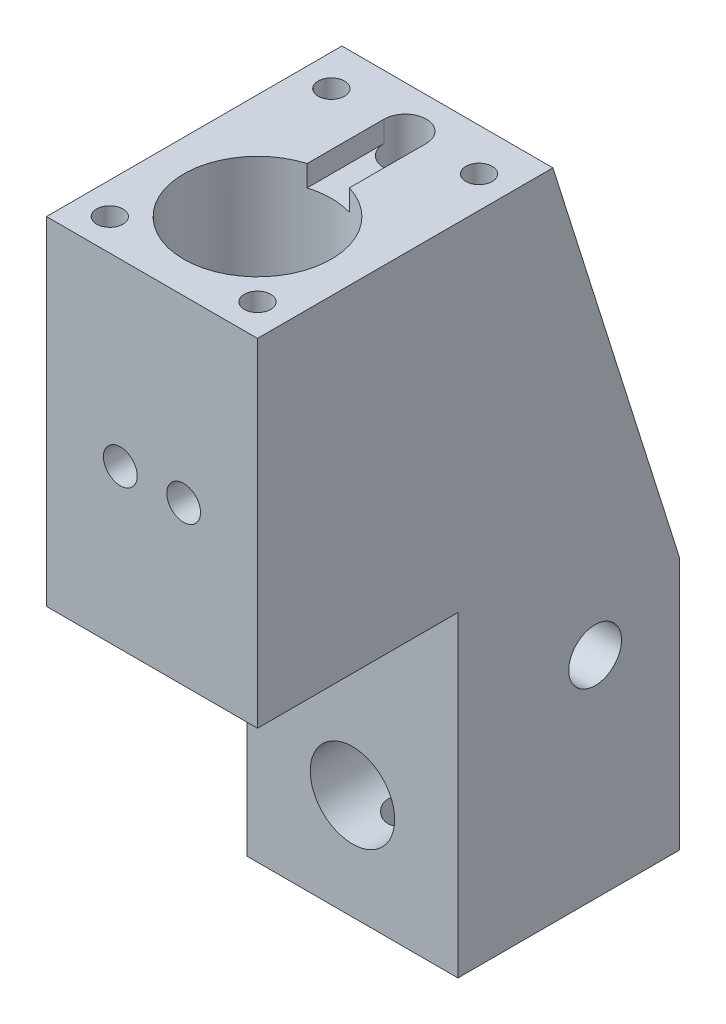
from build123d import *

# Parameters (mm, degrees)
BOSS_EXTRUDE1_DEPTH     = 10
SKETCH2_R               = 7
CUT_EXTRUDE1_DEPTH      = 67.219332525
M3_TAPPED_HOLE1_D       = 2.5
M3_TAPPED_HOLE1_DEPTH   = 8.248924226
M3_TAPPED_HOLE1_TIP     = 0.751075774
CUT_EXTRUDE2_DEPTH      = 2
SKETCH7_R               = 2
CUT_EXTRUDE3_DEPTH      = 30
SKETCH8_R               = 1.25
CUT_EXTRUDE4_DEPTH      = 49
CUT_EXTRUDE5_REACH      = 76.458
CUT_EXTRUDE5_END_RADIUS = 7
SKETCH9_R               = 1.6
SKETCH10_R              = 2.5
CUT_EXTRUDE6_DEPTH      = 69.447059925
CUT_EXTRUDE7_REACH      = 68.219
CUT_EXTRUDE7_END_RADIUS = 2.5
SKETCH11_R              = 1.25
CUT_EXTRUDE8_REACH      = 68.219
SKETCH12_R              = 4
M4_TAPPED_HOLE1_D       = 3.3
M4_TAPPED_HOLE1_DEPTH   = 9.008579979
M4_TAPPED_HOLE1_TIP     = 0.991420021


with BuildPart() as part:
    # Sketch1 → Boss-Extrude1 (new, symmetric)
    with BuildSketch(Plane(origin=(0, 0, 0), x_dir=(0, 0, -1), z_dir=(1, 0, 0))):
        Polygon((0, 0), (0, 30), (-19, 30), (-19, 62), (9, 62), (21, 24), (21, 0), align=None)
    extrude(amount=BOSS_EXTRUDE1_DEPTH, both=True)

    # Sketch2 → Cut-Extrude1 (cut, through all)
    with BuildSketch(Plane(origin=(0, 62, 0), x_dir=(1, 0, 0), z_dir=(0, 1, 0))):
        with Locations(Location((0, -9, 0), (0, 0, 270))):
            Circle(SKETCH2_R)
    extrude(amount=-CUT_EXTRUDE1_DEPTH, mode=Mode.SUBTRACT)

    # M3 Tapped Hole1
    with Locations(Plane(origin=(0, 62, 0), x_dir=(1, 0, 0), z_dir=(0, 1, 0))):
        with Locations((-7, -16), (7, -16), (7, 5), (-7, 5)):
            Hole(M3_TAPPED_HOLE1_D / 2, depth=M3_TAPPED_HOLE1_DEPTH)
            with Locations((0, 0, -(M3_TAPPED_HOLE1_DEPTH + M3_TAPPED_HOLE1_TIP / 2))):  # 118° drill point
                Cone(0, M3_TAPPED_HOLE1_D / 2, M3_TAPPED_HOLE1_TIP, mode=Mode.SUBTRACT)

    # Sketch6 → Cut-Extrude2 (cut)
    with BuildSketch(Plane(origin=(0, 62, 0), x_dir=(1, 0, 0), z_dir=(0, 1, 0))):
        with BuildLine():
            Line((2, 5), (2, -4.41407825))
            ThreePointArc((2, -4.41407825), (0, -6.41407825), (-2, -4.41407825))
            Line((-2, -4.41407825), (-2, 5))
            ThreePointArc((-2, 5), (0, 7), (2, 5))
        make_face()
    extrude(amount=-CUT_EXTRUDE2_DEPTH, mode=Mode.SUBTRACT)

    # Sketch7 → Cut-Extrude3 (cut)
    with BuildSketch(Plane(origin=(0, 62, 0), x_dir=(1, 0, 0), z_dir=(0, 1, 0))):
        with Locations(Location((0, 5, 0), (0, 0, 270))):
            Circle(SKETCH7_R)
    extrude(amount=-CUT_EXTRUDE3_DEPTH, mode=Mode.SUBTRACT)

    # Sketch8 → Cut-Extrude4 (cut)
    with BuildSketch(Plane(origin=(0, 62, 0), x_dir=(1, 0, 0), z_dir=(0, 1, 0))):
        with Locations(Location((0, 5, 0), (0, 0, 270))):
            Circle(SKETCH8_R)
    extrude(amount=-CUT_EXTRUDE4_DEPTH, mode=Mode.SUBTRACT)

    # Cut-Extrude5: up to this cylinder (the profile starts outside it)
    cut_extrude5_end = Plane(origin=(0, 45, 9), z_dir=(0, 1, 0)) * Cylinder(CUT_EXTRUDE5_END_RADIUS, 167.916, mode=Mode.PRIVATE)
    # Sketch9 → Cut-Extrude5 (cut, up to the surface)
    with BuildSketch(Plane.XY.offset(19), mode=Mode.PRIVATE) as cut_extrude5_sk1:
        with Locations((-3, 45)):
            Circle(SKETCH9_R)
    cut_extrude5_tool1 = extrude(cut_extrude5_sk1.sketch, amount=-CUT_EXTRUDE5_REACH, mode=Mode.PRIVATE) - cut_extrude5_end
    add(cut_extrude5_tool1.solids().sort_by_distance((-3, 45, 19))[0], mode=Mode.SUBTRACT)
    # Sketch9 → Cut-Extrude5 (cut, up to the surface)
    with BuildSketch(Plane.XY.offset(19), mode=Mode.PRIVATE) as cut_extrude5_sk2:
        with Locations((3, 45)):
            Circle(SKETCH9_R)
    cut_extrude5_tool2 = extrude(cut_extrude5_sk2.sketch, amount=-CUT_EXTRUDE5_REACH, mode=Mode.PRIVATE) - cut_extrude5_end
    add(cut_extrude5_tool2.solids().sort_by_distance((3, 45, 19))[0], mode=Mode.SUBTRACT)

    # Sketch10 → Cut-Extrude6 (cut, through all)
    with BuildSketch(Plane(origin=(10, 0, 0), x_dir=(0, 0, -1), z_dir=(1, 0, 0))):
        with Locations((13, 20)):
            Circle(SKETCH10_R)
    extrude(amount=-CUT_EXTRUDE6_DEPTH, mode=Mode.SUBTRACT)

    # Cut-Extrude7: up to this cylinder (the profile starts outside it)
    cut_extrude7_end = Plane(origin=(0, 20, -13), z_dir=(1, 0, 0)) * Cylinder(CUT_EXTRUDE7_END_RADIUS, 142.438, mode=Mode.PRIVATE)
    # Sketch11 → Cut-Extrude7 (cut, up to the surface)
    with BuildSketch(Plane.XZ, mode=Mode.PRIVATE) as cut_extrude7_sk1:
        with Locations(Location((0, -13, 0), (0, 0, 270))):
            Circle(SKETCH11_R)
    cut_extrude7_tool1 = extrude(cut_extrude7_sk1.sketch, amount=-CUT_EXTRUDE7_REACH, mode=Mode.PRIVATE) - cut_extrude7_end
    add(cut_extrude7_tool1.solids().sort_by_distance((0, 0, -13))[0], mode=Mode.SUBTRACT)

    # Sketch12 → Cut-Extrude8 (cut, up to next)
    with BuildSketch(Plane.XY, mode=Mode.PRIVATE) as cut_extrude8_sk1:
        with Locations((0, 10)):
            Circle(SKETCH12_R)
    cut_extrude8_tool1 = extrude(cut_extrude8_sk1.sketch, amount=-CUT_EXTRUDE8_REACH, mode=Mode.PRIVATE) & part.part
    add(cut_extrude8_tool1.solids().sort_by_distance((0, 10, 0))[0], mode=Mode.SUBTRACT)

    # M4 Tapped Hole1
    with Locations(Plane(origin=(0, 0, 0), x_dir=(-1, 0, 0), z_dir=(0, -1, 0))):
        with Locations((0, 13), (0, 5)):
            Hole(M4_TAPPED_HOLE1_D / 2, depth=M4_TAPPED_HOLE1_DEPTH)
            with Locations((0, 0, -(M4_TAPPED_HOLE1_DEPTH + M4_TAPPED_HOLE1_TIP / 2))):  # 118° drill point
                Cone(0, M4_TAPPED_HOLE1_D / 2, M4_TAPPED_HOLE1_TIP, mode=Mode.SUBTRACT)


solid = part.part
